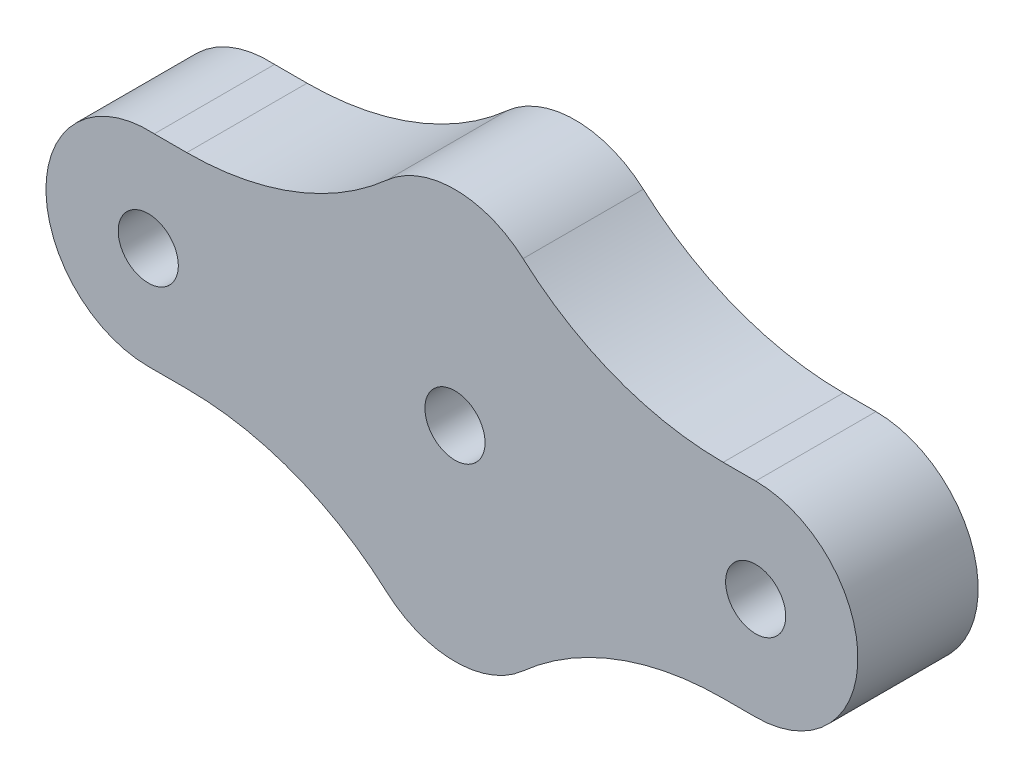
from build123d import *

# Parameters (mm, degrees)
SKETCH1_R           = 0.5
BOSS_EXTRUDE1_DEPTH = 2
FILLET1_R           = 5


with BuildPart() as part:
    # Sketch1 → Boss-Extrude1 (new body)
    with BuildSketch(Plane.XY):
        with BuildLine():
            Line((0, 0), (3.3, 0))
            ThreePointArc((3.3, 0), (5, 1.7), (6.7, 0))
            Line((6.7, 0), (10, 0))
            ThreePointArc((10, 0), (11.7, -1.7), (10, -3.4))
            Line((10, -3.4), (6.7, -3.4))
            ThreePointArc((6.7, -3.4), (5, -5.1), (3.3, -3.4))
            Line((3.3, -3.4), (-0.1, -3.4))
            ThreePointArc((-0.1, -3.4), (-1.800735135, -1.64850779), (0, 0))
        make_face()
        with Locations((-0.1, -1.698529412)):
            Circle(SKETCH1_R, mode=Mode.SUBTRACT)
        with Locations((10, -1.7)):
            Circle(SKETCH1_R, mode=Mode.SUBTRACT)
        with Locations((5, -1.7)):
            Circle(SKETCH1_R, mode=Mode.SUBTRACT)
    extrude(amount=BOSS_EXTRUDE1_DEPTH)

    # Fillet1
    fillet1_edges = [part.edges().sort_by_distance(p)[0] for p in [
        (3.3, 0, 1),
        (6.7, 0, 1),
        (6.7, -3.4, 1),
        (3.3, -3.4, 1),
    ]]
    fillet(fillet1_edges, radius=FILLET1_R)


solid = part.part
